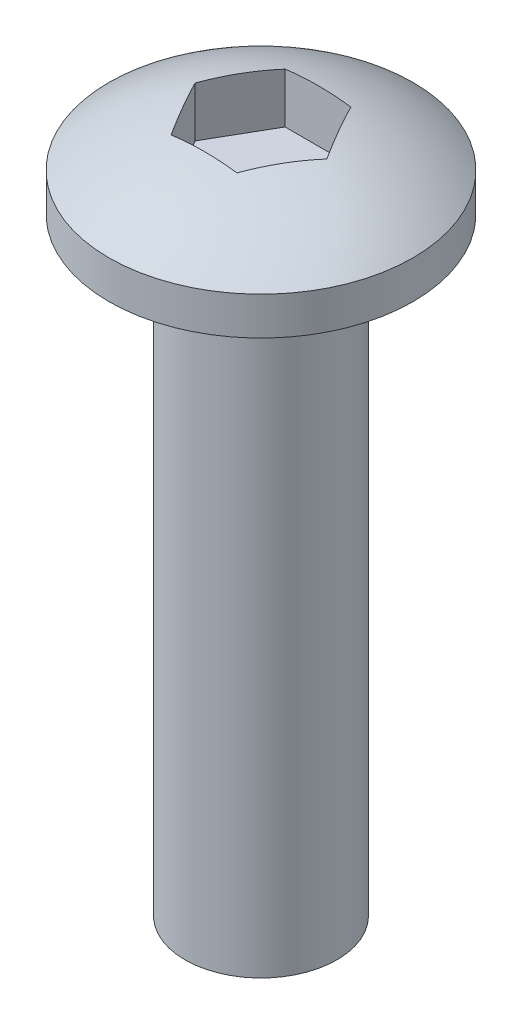
from build123d import *

# Parameters (mm, degrees)
SKETCH1_R           = 1
BOSS_EXTRUDE1_DEPTH = 8
CUT_EXTRUDE1_START  = 9.5
CUT_EXTRUDE1_DEPTH  = 1.1


with BuildPart() as part:
    # Sketch1 → Boss-Extrude1 (new body)
    with BuildSketch(Plane(origin=(0, 0, 0), x_dir=(1, 0, 0), z_dir=(0, 1, 0))):
        with Locations(Location((0, 0, 0), (0, 0, 270))):
            Circle(SKETCH1_R)
    extrude(amount=BOSS_EXTRUDE1_DEPTH)

    # Sketch2 → Revolve2 (revolve)
    with BuildSketch(Plane.XY, mode=Mode.PRIVATE) as revolve2_sk:
        with BuildLine():
            Line((0, 8), (-2, 8))
            Line((-2, 8), (-2, 8.5))
            ThreePointArc((-2, 8.5), (-1.055436608, 9.001787176), (0, 9.17511905))
            Line((0, 9.17511905), (0, 8))
        make_face()
    revolve(revolve2_sk.sketch.rotate(Axis((0, 8, 0), (0, 1, 0)), 180), axis=Axis((0, 8, 0), (0, 1, 0)))

    # Sketch3 → Cut-Extrude1 (cut)
    with BuildSketch(Plane(origin=(0, 0, 0), x_dir=(1, 0, 0), z_dir=(0, 1, 0)).offset(CUT_EXTRUDE1_START)):
        Polygon((0.433012702, -0.75), (0.866025404, 0), (0.433012702, 0.75), (-0.433012702, 0.75), (-0.866025404, 0), (-0.433012702, -0.75), align=None)
    extrude(amount=-CUT_EXTRUDE1_DEPTH, mode=Mode.SUBTRACT)


solid = part.part
